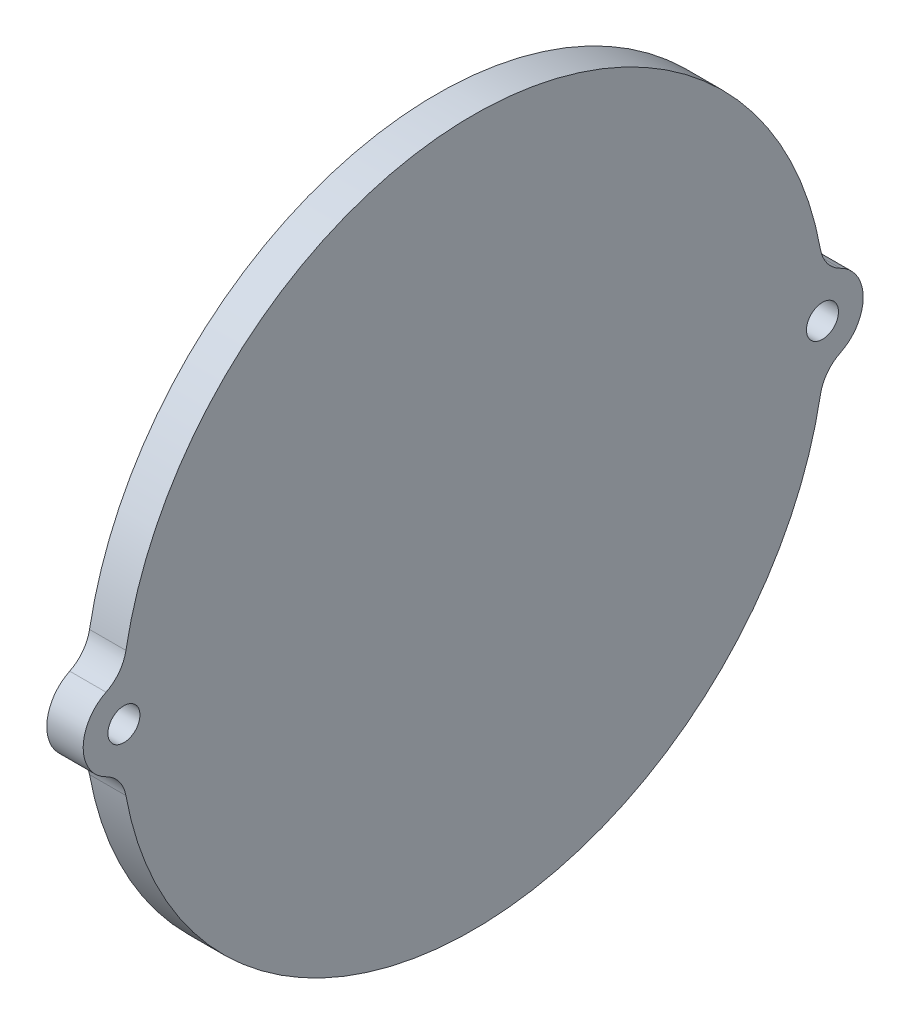
from build123d import *

# Parameters (mm, degrees)
SKETCH2_R               = 2.8
SKETCH2_R_2             = 1.1
BOSS_EXTRUDE1_DEPTH     = 2.5
FILLET1_R               = 2.5
SKETCH4_R               = 17.25
SKETCH4_R_2             = 9.75
BOSS_EXTRUDE2_DEPTH     = 0.5
CUT_EXTRUDE1_DEPTH      = 37.267099556
CUT_EXTRUDE1_DEPTH_BACK = 37.267099556
SKETCH6_R               = 1.1


with BuildPart() as part:
    # Sketch1 → Revolve1 (revolve)
    with BuildSketch(Plane.XY, mode=Mode.PRIVATE) as revolve1_sk:
        Polygon((-2.5, 0), (0, 0), (0, 24.25), (-2.5, 24.25), (-2.5, 19), align=None)
    revolve(revolve1_sk.sketch.rotate(Axis((0, 0, 0), (-1, 0, 0)), 90), axis=Axis((0, 0, 0), (-1, 0, 0)))

    # Sketch2 → Boss-Extrude1 (add)
    # profile 1 of 2: a face of its own
    with BuildSketch(Plane(origin=(0, 0, 0), x_dir=(0, 0, -1), z_dir=(1, 0, 0))):
        with Locations((-24, 0)):
            Circle(SKETCH2_R)
        with Locations((-24, 0)):
            Circle(SKETCH2_R_2, mode=Mode.SUBTRACT)
    # profile 2 of 2: a face of its own
    with BuildSketch(Plane(origin=(0, 0, 0), x_dir=(0, 0, -1), z_dir=(1, 0, 0))):
        with Locations((24, 0)):
            Circle(SKETCH2_R)
        with Locations((24, 0)):
            Circle(SKETCH2_R_2, mode=Mode.SUBTRACT)
    extrude(amount=-BOSS_EXTRUDE1_DEPTH)

    # Fillet1
    fillet1_edges = [part.edges().sort_by_distance(p)[0] for p in [
        (-1.25, 2.798617784, 24.08796875),
        (-1.25, -2.798617784, 24.08796875),
        (-1.25, -2.798617784, -24.08796875),
        (-1.25, 2.798617784, -24.08796875),
    ]]
    fillet(fillet1_edges, radius=FILLET1_R)

    # Sketch4 → Boss-Extrude2 (add)
    with BuildSketch(Plane.ZY.offset(2.5)):
        Circle(SKETCH4_R)
        Circle(SKETCH4_R_2, mode=Mode.SUBTRACT)
    extrude(amount=BOSS_EXTRUDE2_DEPTH)

    # Sketch6 → Cut-Extrude1 (cut, two sides: drawn at the far end of the back side and taken through both)
    with BuildSketch(Plane(origin=(0, 0, 0), x_dir=(0, 0, -1), z_dir=(1, 0, 0)).offset(-CUT_EXTRUDE1_DEPTH_BACK)):
        with Locations((-24, 0)):
            Circle(SKETCH6_R)
        with Locations(Location((24, 0, 0), (0, 0, 180))):
            Circle(SKETCH6_R)
    extrude(amount=CUT_EXTRUDE1_DEPTH + CUT_EXTRUDE1_DEPTH_BACK, mode=Mode.SUBTRACT)


solid = part.part
